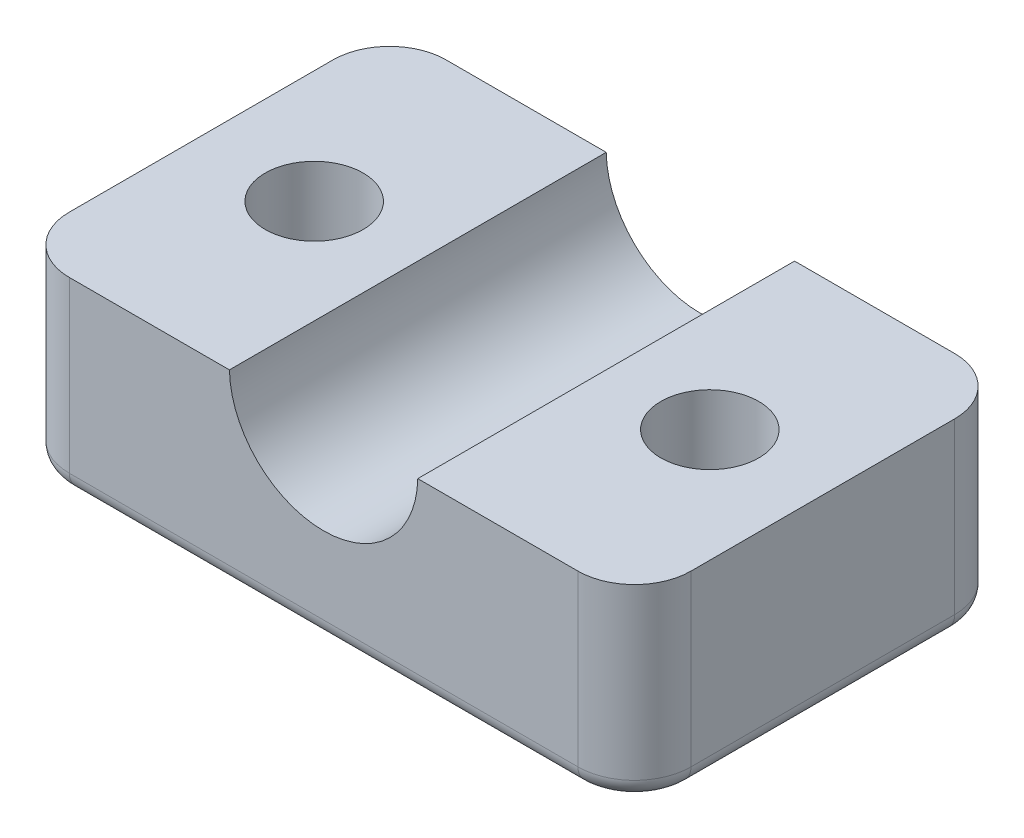
from build123d import *

# Parameters (mm, degrees)
SKETCH1_R           = 2.6
BOSS_EXTRUDE3_DEPTH = 10
SKETCH5_R           = 5
CUT_EXTRUDE3_DEPTH  = 20
FILLET2_R           = 1


with BuildPart() as part:
    # Sketch1 → Boss-Extrude3 (new body)
    with BuildSketch(Plane(origin=(0, 0, 0), x_dir=(1, 0, 0), z_dir=(0, 1, 0))):
        with BuildLine():
            Line((-13.5, -10), (13.5, -10))
            ThreePointArc((13.5, -10), (15.621320344, -9.121320344), (16.5, -7))
            Line((16.5, -7), (16.5, 7))
            ThreePointArc((16.5, 7), (15.621320344, 9.121320344), (13.5, 10))
            Line((13.5, 10), (-13.5, 10))
            ThreePointArc((-13.5, 10), (-15.621320344, 9.121320344), (-16.5, 7))
            Line((-16.5, 7), (-16.5, -7))
            ThreePointArc((-16.5, -7), (-15.621320344, -9.121320344), (-13.5, -10))
        make_face()
        with Locations(Location((10.5, 0, 0), (0, 0, 270))):
            Circle(SKETCH1_R, mode=Mode.SUBTRACT)
        with Locations(Location((-10.5, 0, 0), (0, 0, 90))):
            Circle(SKETCH1_R, mode=Mode.SUBTRACT)
    extrude(amount=BOSS_EXTRUDE3_DEPTH)

    # Sketch5 → Cut-Extrude3 (cut)
    with BuildSketch(Plane(origin=(0, 0, -10), x_dir=(-1, 0, 0), z_dir=(0, 0, -1))):
        with Locations((0, 10.1)):
            Circle(SKETCH5_R)
    extrude(amount=-CUT_EXTRUDE3_DEPTH, mode=Mode.SUBTRACT)

    # Fillet2
    fillet2_edges = [part.edges().sort_by_distance(p)[0] for p in [
        (0, 0, 10),
        (-15.621320344, 0, 9.121320344),
        (-16.5, 0, 0),
        (-15.621320344, 0, -9.121320344),
        (0, 0, -10),
        (15.621320344, 0, -9.121320344),
        (16.5, 0, 0),
        (15.621320344, 0, 9.121320344),
    ]]
    fillet(fillet2_edges, radius=FILLET2_R)


solid = part.part
